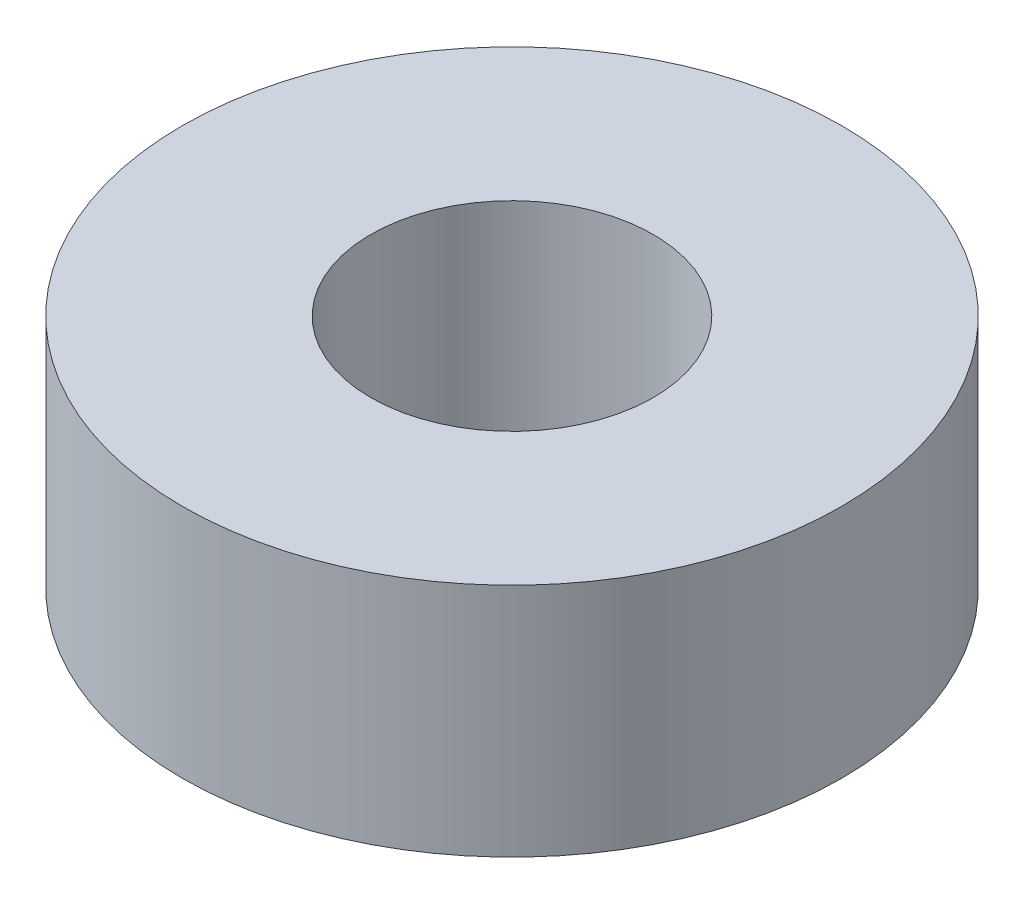
from build123d import *

# Parameters (mm, degrees)
SKETCH1_R           = 7
SKETCH1_R_2         = 3
BOSS_EXTRUDE1_DEPTH = 5


with BuildPart() as part:
    # Sketch1 → Boss-Extrude1 (new body)
    with BuildSketch(Plane(origin=(0, 0, 0), x_dir=(1, 0, 0), z_dir=(0, 1, 0))):
        with Locations(Location((0, 0, 0), (0, 0, 270))):
            Circle(SKETCH1_R)
        with Locations(Location((0, 0, 0), (0, 0, 270))):
            Circle(SKETCH1_R_2, mode=Mode.SUBTRACT)
    extrude(amount=BOSS_EXTRUDE1_DEPTH)


solid = part.part
